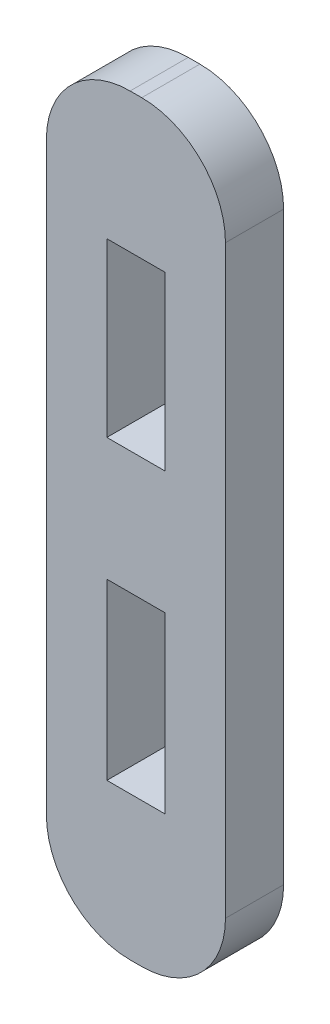
from build123d import *

# Parameters (mm, degrees)
SKETCH1_W           = 4.8895
SKETCH1_H           = 20.545176785
BOSS_EXTRUDE1_DEPTH = 1.5875
CUT_EXTRUDE1_DEPTH  = 22.178565948
FILLET1_R           = 2.286


with BuildPart() as part:
    # Sketch1 → Boss-Extrude1 (new body)
    with BuildSketch(Plane.XY):
        with Locations((2.44475, 10.272588393)):
            Rectangle(SKETCH1_W, SKETCH1_H)
    extrude(amount=BOSS_EXTRUDE1_DEPTH)

    # Sketch2 → Cut-Extrude1 (cut, through all)
    with BuildSketch(Plane(origin=(0, 0, 0), x_dir=(-1, 0, 0), z_dir=(0, 0, -1))):
        Polygon((-3.2385, 14.195176785), (-3.2385, 12.036176785), (-1.651, 12.036176785), (-1.651, 14.195176785), (-1.651, 15.351361919), (-1.651, 15.678636285), (-1.651, 16.735176785), (-3.2385, 16.735176785), (-3.2385, 15.678636285), (-3.2385, 15.351361919), align=None)
        Polygon((-1.651, 5.223280418), (-1.651, 6.407477123), (-1.651, 8.684242536), (-3.2385, 8.684242536), (-3.2385, 6.407477123), (-3.2385, 5.223280418), (-3.2385, 4.866564699), (-3.2385, 3.927789612), (-1.651, 3.927789612), (-1.651, 4.866564699), align=None)
    extrude(amount=-CUT_EXTRUDE1_DEPTH, mode=Mode.SUBTRACT)

    # Fillet1
    fillet1_edges = [part.edges().sort_by_distance(p)[0] for p in [
        (0, 20.545176785, 0.79375),
        (4.8895, 20.545176785, 0.79375),
        (4.8895, 0, 0.79375),
        (0, 0, 0.79375),
    ]]
    fillet(fillet1_edges, radius=FILLET1_R)


solid = part.part
